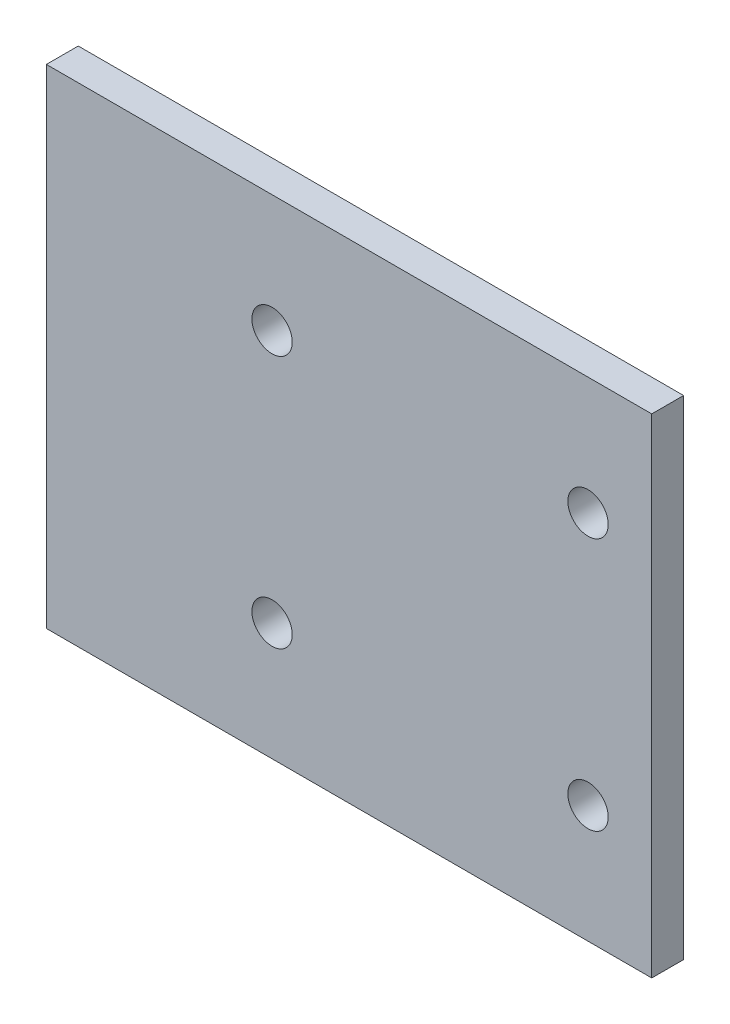
from build123d import *

# Parameters (mm, degrees)
SKETCH1_W             = 57
SKETCH1_H             = 46
BOSS_EXTRUDE1_DEPTH   = 3
F_6_CLEARANCE_HOLE1_D = 3.7973


with BuildPart() as part:
    # Sketch1 → Boss-Extrude1 (new body)
    with BuildSketch(Plane.XY):
        with Locations((-7.514344262, 1.590163934)):
            Rectangle(SKETCH1_W, SKETCH1_H)
    extrude(amount=BOSS_EXTRUDE1_DEPTH)

    # #6 Clearance Hole1 (through all)
    with Locations(Plane.XY.offset(3)):
        with Locations((14.985655738, 13.515163934), (14.985655738, -10.334836066), (-14.764344262, -10.334836066), (-14.764344262, 13.515163934)):
            Hole(F_6_CLEARANCE_HOLE1_D / 2)


solid = part.part
